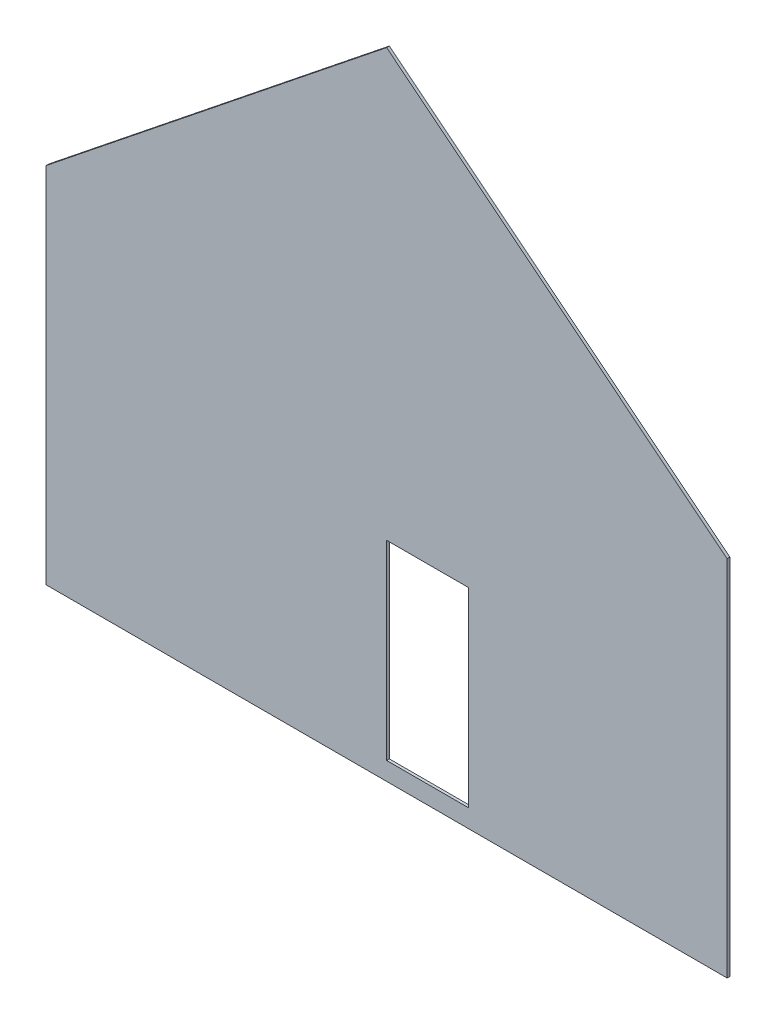
from build123d import *

# Parameters (mm, degrees)
BOSS_EXTRUDE1_DEPTH = 30
SKETCH2_W           = 900
SKETCH2_H           = 2100
CUT_EXTRUDE1_DEPTH  = 1353


with BuildPart() as part:
    # Sketch1 → Boss-Extrude1 (new body)
    with BuildSketch(Plane.XY):
        Polygon((0, 0), (7500, 0), (7500, 4000), (3750, 7000), (0, 4000), align=None)
    extrude(amount=BOSS_EXTRUDE1_DEPTH)

    # Sketch2 → Cut-Extrude1 (cut)
    with BuildSketch(Plane.XY.offset(30)):
        with Locations((4200, 1250)):
            Rectangle(SKETCH2_W, SKETCH2_H)
    extrude(amount=-CUT_EXTRUDE1_DEPTH, mode=Mode.SUBTRACT)


solid = part.part
